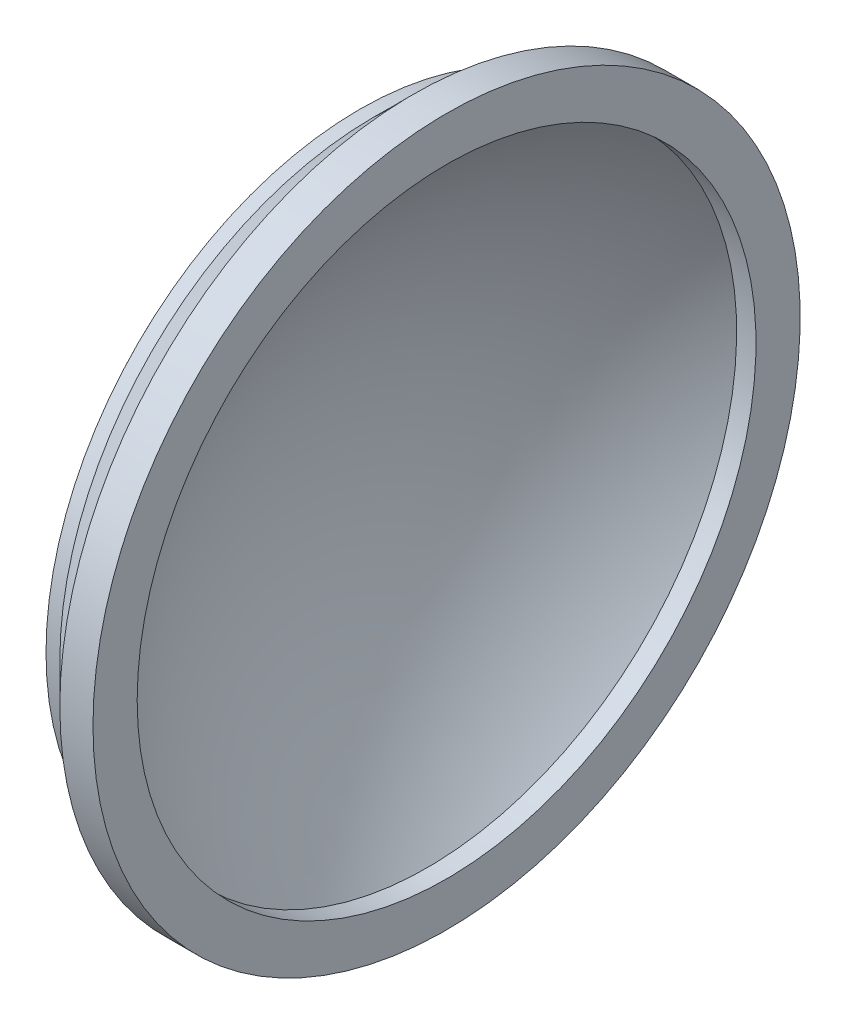
from build123d import *


with BuildPart() as part:
    # Sketch1 → Revolve1 (revolve)
    with BuildSketch(Plane.XY, mode=Mode.PRIVATE) as revolve1_sk:
        with BuildLine():
            Line((-31.720385191, 56.779614809), (-29.220385191, 56.779614809))
            Line((-29.220385191, 56.779614809), (-22, 64))
            Line((-22, 64), (-16, 64))
            Line((-16, 64), (-16, 56))
            Line((-16, 56), (-19.500883608, 56))
            ThreePointArc((-19.500883608, 56), (-35.117990054, 29.913629212), (-40.555594493, 0))
            Line((-40.555594493, 0), (-50.555594493, 0))
            ThreePointArc((-50.555594493, 0), (-45.723923512, 29.911075571), (-31.720385191, 56.779614809))
        make_face()
    revolve(revolve1_sk.sketch.rotate(Axis((-128.545758478, 0, 0), (1, 0, 0)), 90), axis=Axis((-128.545758478, 0, 0), (1, 0, 0)))


solid = part.part
